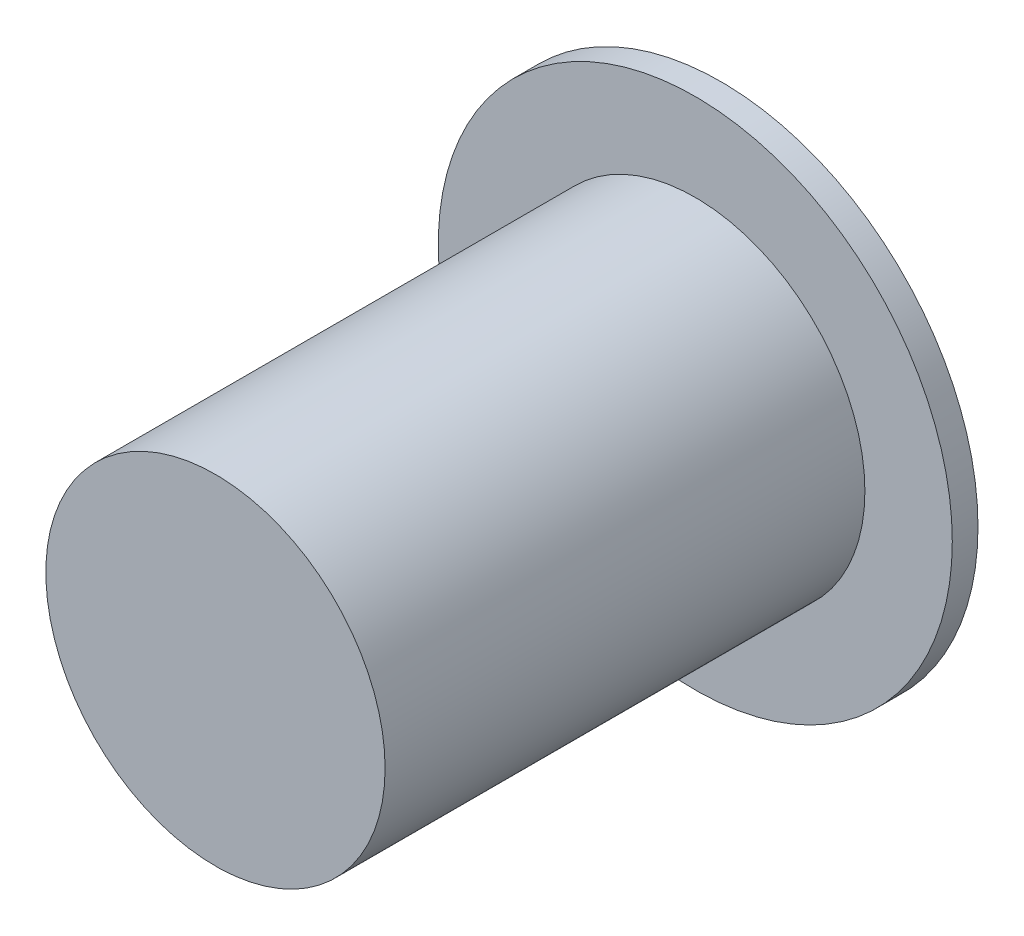
from build123d import *

# Parameters (mm, degrees)
SKETCH1_R           = 15
BOSS_EXTRUDE1_DEPTH = 1.5
SKETCH2_R           = 9.9
BOSS_EXTRUDE2_DEPTH = 28


with BuildPart() as part:
    # Sketch1 → Boss-Extrude1 (new body)
    with BuildSketch(Plane.XY):
        Circle(SKETCH1_R)
    extrude(amount=BOSS_EXTRUDE1_DEPTH)

    # Sketch2 → Boss-Extrude2 (add)
    with BuildSketch(Plane.XY.offset(1.5)):
        Circle(SKETCH2_R)
    extrude(amount=BOSS_EXTRUDE2_DEPTH)


solid = part.part
